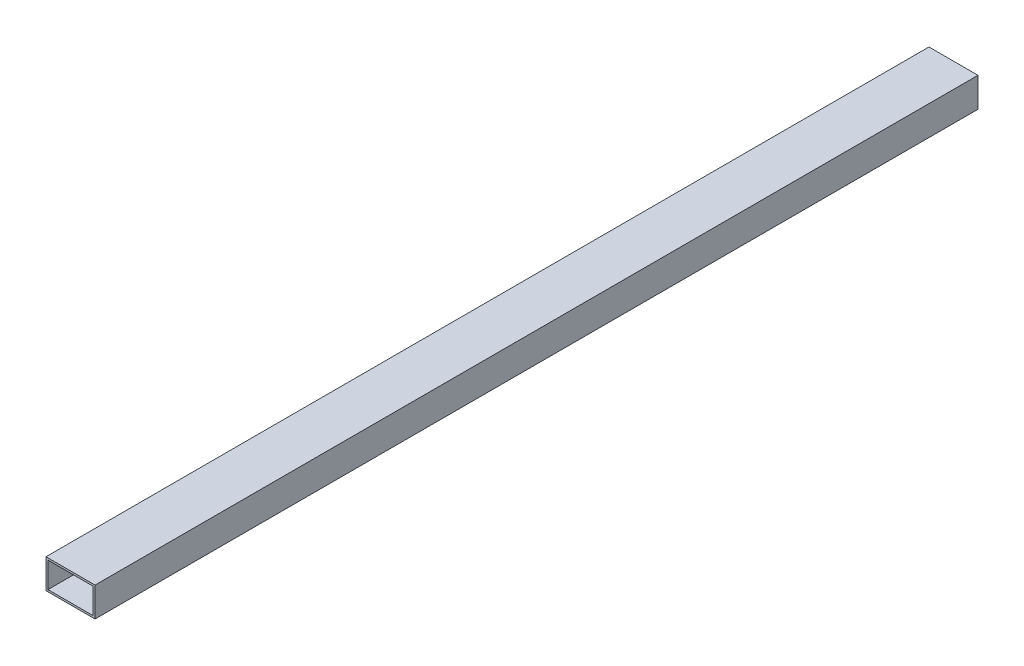
from build123d import *

# Parameters (mm, degrees)
SKETCH1_W           = 50
SKETCH1_H           = 30
SKETCH1_W_2         = 46
SKETCH1_H_2         = 26
BOSS_EXTRUDE1_DEPTH = 450


with BuildPart() as part:
    # Sketch1 → Boss-Extrude1 (new, symmetric)
    with BuildSketch(Plane.XY):
        Rectangle(SKETCH1_W, SKETCH1_H)
        Rectangle(SKETCH1_W_2, SKETCH1_H_2, mode=Mode.SUBTRACT)
    extrude(amount=BOSS_EXTRUDE1_DEPTH, both=True)


solid = part.part
